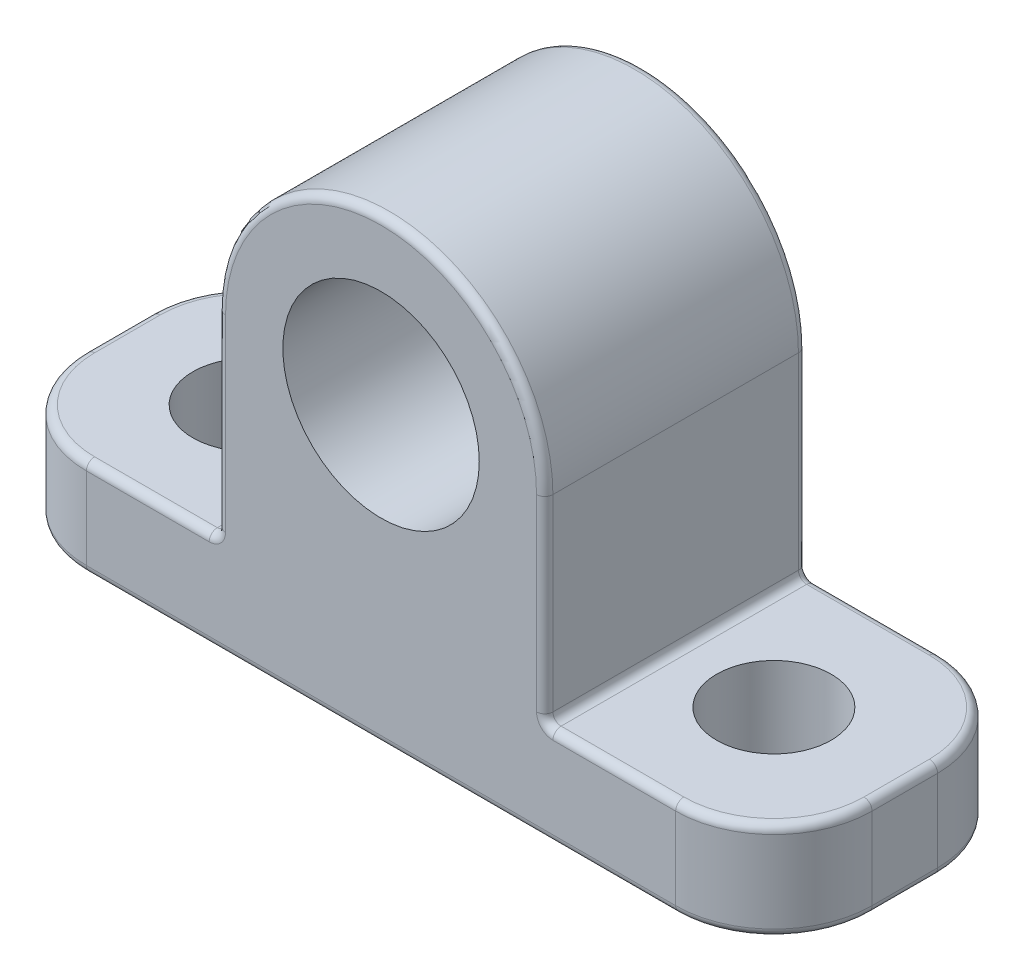
from build123d import *

# Parameters (mm, degrees)
SKETCH1_R           = 3
BOSS_EXTRUDE1_DEPTH = 8
SKETCH2_OUTSIDE_W   = 31.782
SKETCH2_OUTSIDE_H   = 15.782
SKETCH2_OUTSIDE_R   = 1.75
CUT_EXTRUDE1_DEPTH  = 8
FILLET1_R           = 0.25


with BuildPart() as part:
    # Sketch1 → Boss-Extrude1 (new body)
    with BuildSketch(Plane.XY):
        with BuildLine():
            Line((-12, 0), (12, 0))
            Line((12, 0), (12, 3))
            Line((12, 3), (5, 3))
            Line((5, 3), (5, 9))
            ThreePointArc((5, 9), (0, 14), (-5, 9))
            Line((-5, 9), (-5, 3))
            Line((-5, 3), (-12, 3))
            Line((-12, 3), (-12, 0))
        make_face()
        with Locations((0, 9)):
            Circle(SKETCH1_R, mode=Mode.SUBTRACT)
    extrude(amount=-BOSS_EXTRUDE1_DEPTH)

    # Sketch2 outside → Cut-Extrude1 (cut)
    # profile 1 of 3: a face of its own
    with BuildSketch(Plane(origin=(0, 3, 0), x_dir=(1, 0, 0), z_dir=(0, 1, 0))):
        with Locations((0, 4)):
            Rectangle(SKETCH2_OUTSIDE_W, SKETCH2_OUTSIDE_H)
        with BuildLine():
            Line((-8, 8), (-9, 8))
            ThreePointArc((-9, 8), (-11.121320344, 7.121320344), (-12, 5))
            Line((-12, 5), (-12, 3))
            ThreePointArc((-12, 3), (-11.121320344, 0.878679656), (-9, 0))
            Line((-9, 0), (-8, 0))
            Line((-8, 0), (8, 0))
            Line((8, 0), (9, 0))
            ThreePointArc((9, 0), (11.121320344, 0.878679656), (12, 3))
            Line((12, 3), (12, 5))
            ThreePointArc((12, 5), (11.121320344, 7.121320344), (9, 8))
            Line((9, 8), (8, 8))
            Line((8, 8), (-8, 8))
        make_face(mode=Mode.SUBTRACT)
    # profile 2 of 3: a face of its own
    with BuildSketch(Plane(origin=(0, 3, 0), x_dir=(1, 0, 0), z_dir=(0, 1, 0))):
        with Locations(Location((8, 4, 0), (0, 0, 180))):
            Circle(SKETCH2_OUTSIDE_R)
    # profile 3 of 3: a face of its own
    with BuildSketch(Plane(origin=(0, 3, 0), x_dir=(1, 0, 0), z_dir=(0, 1, 0))):
        with Locations(Location((-8, 4, 0), (0, 0, 180))):
            Circle(SKETCH2_OUTSIDE_R)
    extrude(amount=-CUT_EXTRUDE1_DEPTH, mode=Mode.SUBTRACT)

    # Fillet1
    fillet1_edges = [part.edges().sort_by_distance(p)[0] for p in [
        (-5, 3, -4),
        (5, 3, -4),
        (5, 6, -8),
        (0, 14, -8),
        (-5, 6, -8),
        (0, 0, 0),
        (7, 3, 0),
        (-7, 3, -8),
        (7, 3, -8),
        (0, 0, -8),
        (-12, 0, -4),
        (12, 0, -4),
        (12, 3, -4),
        (-12, 3, -4),
        (-6.25, 0, -4),
        (11.121320344, 0, -7.121320344),
        (11.121320344, 3, -7.121320344),
        (11.121320344, 0, -0.878679656),
        (11.121320344, 3, -0.878679656),
        (-11.121320344, 0, -0.878679656),
        (-11.121320344, 3, -0.878679656),
        (-11.121320344, 0, -7.121320344),
        (-11.121320344, 3, -7.121320344),
        (9.75, 0, -4),
        (-7, 3, 0),
        (-5, 6, 0),
        (0, 14, 0),
        (5, 6, 0),
    ]]
    fillet(fillet1_edges, radius=FILLET1_R)


solid = part.part
